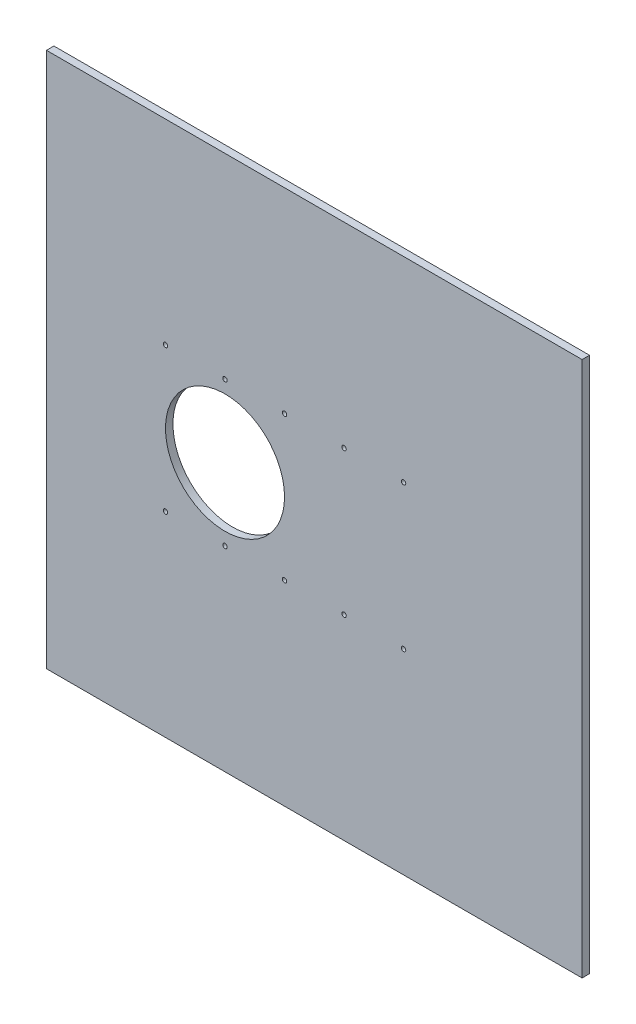
from build123d import *

# Parameters (mm, degrees)
SKETCH1_W                                         = 457.2
SKETCH1_H                                         = 457.2
SKETCH1_R                                         = 50.8
BOSS_EXTRUDE1_DEPTH                               = 6.35
CSK_FOR_6_FLAT_HEAD_MACHINE_SCREW_100_D           = 3.7973
CSK_FOR_6_FLAT_HEAD_MACHINE_SCREW_100_CSINK_D     = 7.0866
CSK_FOR_6_FLAT_HEAD_MACHINE_SCREW_100_CSINK_ANGLE = 100


with BuildPart() as part:
    # Sketch1 → Boss-Extrude1 (new body)
    with BuildSketch(Plane.XY):
        with Locations((228.6, 228.6)):
            Rectangle(SKETCH1_W, SKETCH1_H)
        with Locations((152.4, 228.6)):
            Circle(SKETCH1_R, mode=Mode.SUBTRACT)
    extrude(amount=BOSS_EXTRUDE1_DEPTH)

    # CSK for #6 Flat Head Machine Screw (100)1 (through all)
    with Locations(Plane(origin=(0, 0, 0), x_dir=(-1, 0, 0), z_dir=(0, 0, -1))):
        with Locations((-101.6, 290.195), (-152.4, 290.195), (-203.2, 290.195), (-203.2, 167.005), (-152.4, 167.005), (-101.6, 167.005), (-254, 290.195), (-304.8, 290.195), (-304.8, 167.005), (-254, 167.005)):
            CounterSinkHole(CSK_FOR_6_FLAT_HEAD_MACHINE_SCREW_100_D / 2, CSK_FOR_6_FLAT_HEAD_MACHINE_SCREW_100_CSINK_D / 2, counter_sink_angle=CSK_FOR_6_FLAT_HEAD_MACHINE_SCREW_100_CSINK_ANGLE)


solid = part.part
